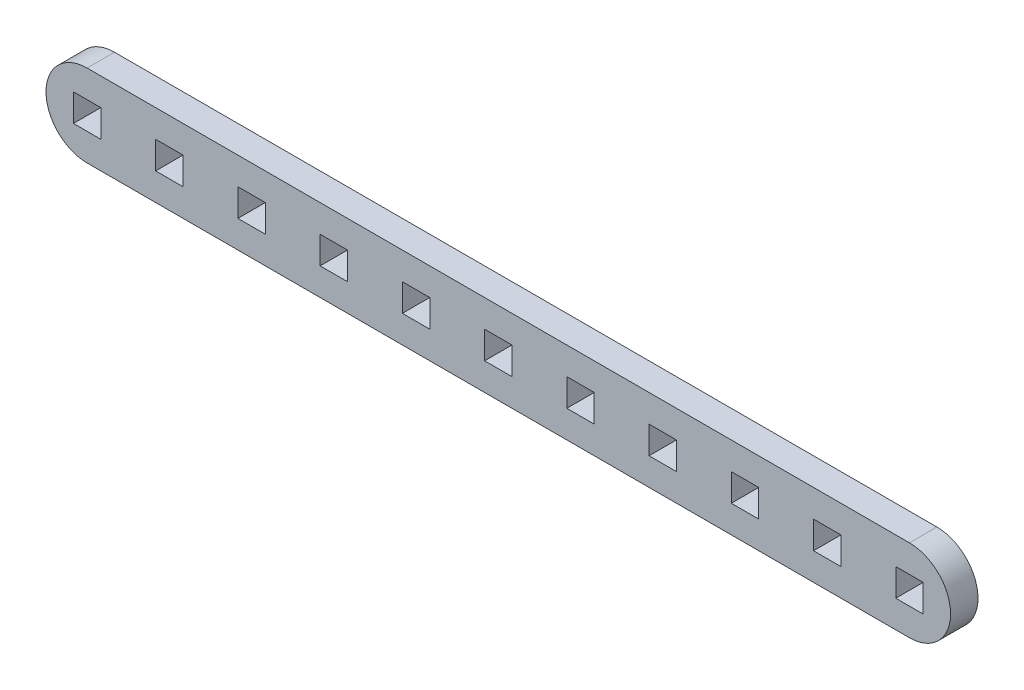
from build123d import *

# Parameters (mm, degrees)
MODEL_W                 = 3
MODEL_H                 = 3
SALIENTE_EXTRUIR1_DEPTH = 3


with BuildPart() as part:
    # Model → Saliente-Extruir1 (new body)
    with BuildSketch(Plane.XY):
        with BuildLine():
            Line((9.904781567, 296.774995526), (99.904781567, 296.774995526))
            ThreePointArc((99.904781567, 296.774995526), (104.404781567, 292.274995526), (99.904781567, 287.774995526))
            Line((99.904781567, 287.774995526), (9.904781567, 287.774995526))
            ThreePointArc((9.904781567, 287.774995526), (5.404781567, 292.274995526), (9.904781567, 296.774995526))
        make_face()
        with Locations((9.904781567, 292.274995526)):
            Rectangle(MODEL_W, MODEL_H, mode=Mode.SUBTRACT)
        with Locations((18.904781567, 292.274995526)):
            Rectangle(MODEL_W, MODEL_H, mode=Mode.SUBTRACT)
        with Locations((27.904781567, 292.274995526)):
            Rectangle(MODEL_W, MODEL_H, mode=Mode.SUBTRACT)
        with Locations((36.904781567, 292.274995526)):
            Rectangle(MODEL_W, MODEL_H, mode=Mode.SUBTRACT)
        with Locations((45.904781567, 292.274995526)):
            Rectangle(MODEL_W, MODEL_H, mode=Mode.SUBTRACT)
        with Locations((54.904781567, 292.274995526)):
            Rectangle(MODEL_W, MODEL_H, mode=Mode.SUBTRACT)
        with Locations((63.904781567, 292.274995526)):
            Rectangle(MODEL_W, MODEL_H, mode=Mode.SUBTRACT)
        with Locations((72.904781567, 292.274995526)):
            Rectangle(MODEL_W, MODEL_H, mode=Mode.SUBTRACT)
        with Locations((81.904781567, 292.274995526)):
            Rectangle(MODEL_W, MODEL_H, mode=Mode.SUBTRACT)
        with Locations((90.904781567, 292.274995526)):
            Rectangle(MODEL_W, MODEL_H, mode=Mode.SUBTRACT)
        with Locations((99.904781567, 292.274995526)):
            Rectangle(MODEL_W, MODEL_H, mode=Mode.SUBTRACT)
    extrude(amount=SALIENTE_EXTRUIR1_DEPTH)


solid = part.part
